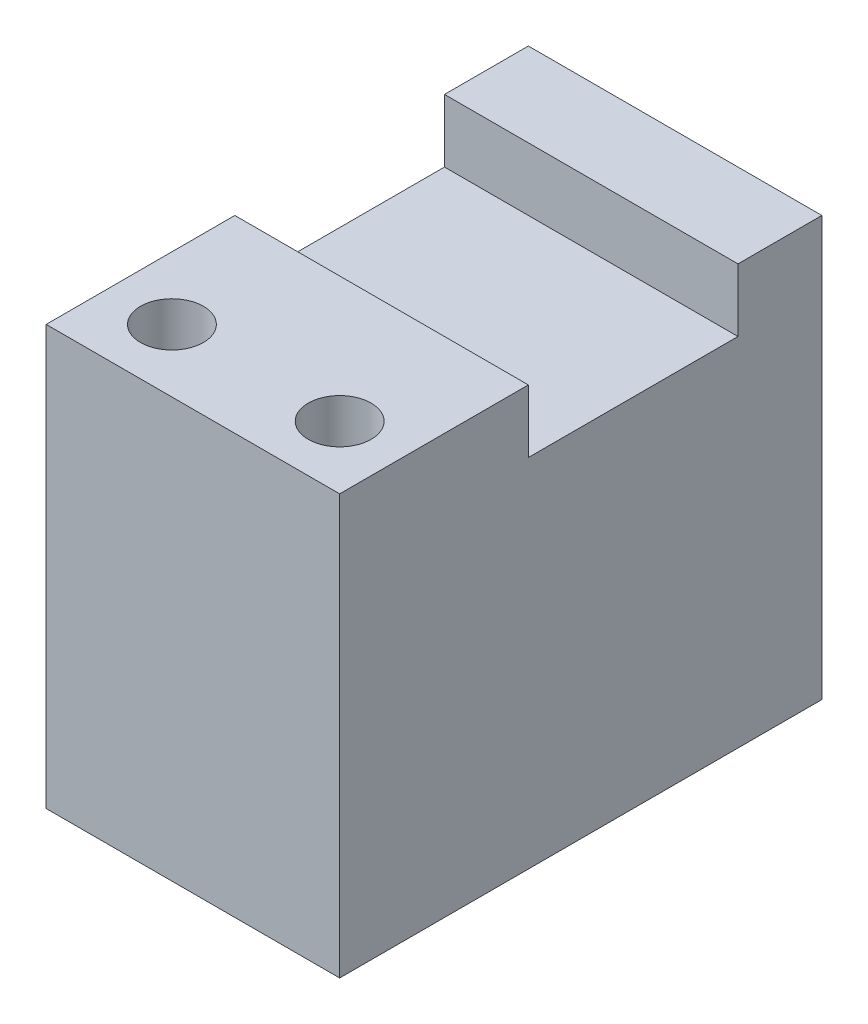
from build123d import *

# Parameters (mm, degrees)
SKETCH1_W                    = 14
SKETCH1_H                    = 23
BOSS_EXTRUDE1_DEPTH          = 20
SKETCH2_W                    = 14
SKETCH2_H                    = 10
CUT_EXTRUDE1_DEPTH           = 3
F_3_0_3_DIAMETER_HOLE1_D     = 3
F_3_0_3_DIAMETER_HOLE1_DEPTH = 5
F_3_0_3_DIAMETER_HOLE1_TIP   = 0.901290929
M10X1_0_TAPPED_HOLE1_D       = 9
M10X1_0_TAPPED_HOLE1_DEPTH   = 12
M10X1_0_TAPPED_HOLE1_TIP     = 2.703872786


with BuildPart() as part:
    # Sketch1 → Boss-Extrude1 (new body)
    with BuildSketch(Plane(origin=(0, 0, 0), x_dir=(1, 0, 0), z_dir=(0, 1, 0))):
        with Locations((7, 11.5)):
            Rectangle(SKETCH1_W, SKETCH1_H)
    extrude(amount=-BOSS_EXTRUDE1_DEPTH)

    # Sketch2 → Cut-Extrude1 (cut)
    with BuildSketch(Plane(origin=(0, 0, 0), x_dir=(1, 0, 0), z_dir=(0, 1, 0))):
        with Locations((7, 14)):
            Rectangle(SKETCH2_W, SKETCH2_H)
    extrude(amount=-CUT_EXTRUDE1_DEPTH, mode=Mode.SUBTRACT)

    # Ø3.0 (3) Diameter Hole1
    with Locations(Plane(origin=(0, 0, 0), x_dir=(1, 0, 0), z_dir=(0, 1, 0))):
        with Locations((11, 3), (3, 3)):
            Hole(F_3_0_3_DIAMETER_HOLE1_D / 2, depth=F_3_0_3_DIAMETER_HOLE1_DEPTH)
            with Locations((0, 0, -(F_3_0_3_DIAMETER_HOLE1_DEPTH + F_3_0_3_DIAMETER_HOLE1_TIP / 2))):  # 118° drill point
                Cone(0, F_3_0_3_DIAMETER_HOLE1_D / 2, F_3_0_3_DIAMETER_HOLE1_TIP, mode=Mode.SUBTRACT)

    # M10x1.0 Tapped Hole1
    with Locations(Plane(origin=(0, -20, 0), x_dir=(-1, 0, 0), z_dir=(0, -1, 0))):
        with Locations((-7, 15)):
            Hole(M10X1_0_TAPPED_HOLE1_D / 2, depth=M10X1_0_TAPPED_HOLE1_DEPTH)
            with Locations((0, 0, -(M10X1_0_TAPPED_HOLE1_DEPTH + M10X1_0_TAPPED_HOLE1_TIP / 2))):  # 118° drill point
                Cone(0, M10X1_0_TAPPED_HOLE1_D / 2, M10X1_0_TAPPED_HOLE1_TIP, mode=Mode.SUBTRACT)


solid = part.part
